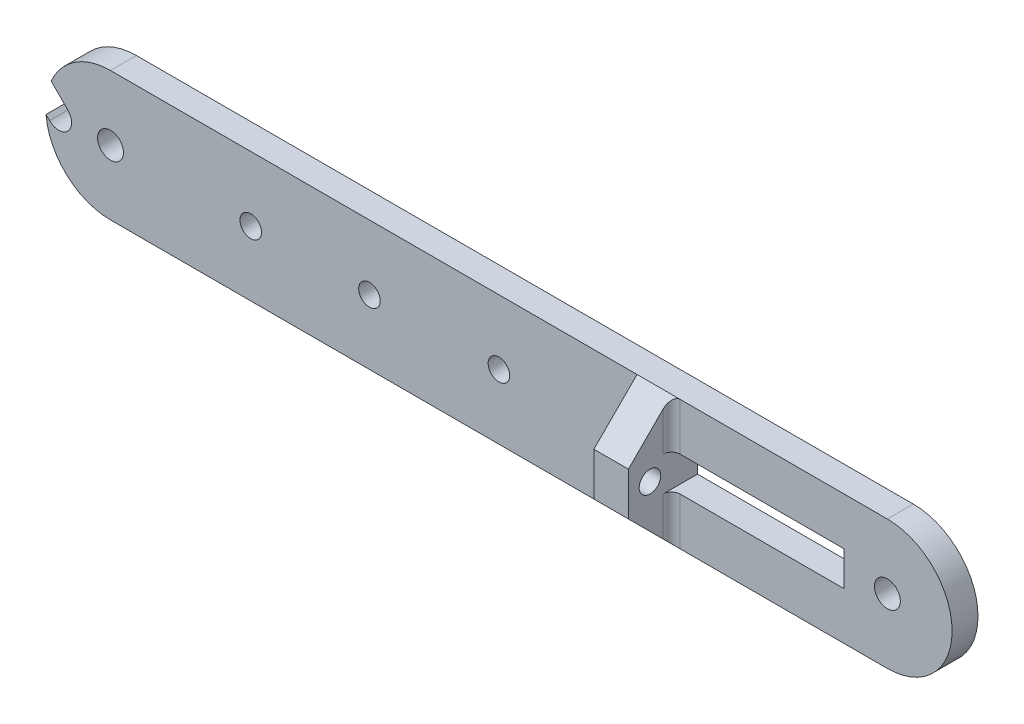
from build123d import *

# Parameters (mm, degrees)
ESQUISSE1_R             = 3
ESQUISSE1_R_2           = 2.5
ESQUISSE1_W             = 40
ESQUISSE1_H             = 8
BOSS_EXTRU_1_DEPTH      = 6
ESQUISSE2_R             = 2.5
BOSS_EXTRU_2_DEPTH      = 8
CONG_2_R                = 2
ENL_V_MAT_EXTRU_1_DEPTH = 4
ENL_V_START             = -10
ENL_V_MAT_EXTRU_4_DEPTH = 10


with BuildPart() as part:
    # Esquisse1 → Boss.-Extru.1 (new body)
    with BuildSketch(Plane.XY):
        with BuildLine():
            Line((90, -15), (-90, -15))
            ThreePointArc((-90, -15), (-105, 0), (-90, 15))
            Line((-90, 15), (90, 15))
            ThreePointArc((90, 15), (105, 0), (90, -15))
        make_face()
        with Locations((90, 0)):
            Circle(ESQUISSE1_R, mode=Mode.SUBTRACT)
        with Locations(Location((-90, 0, 0), (0, 0, 180))):
            Circle(ESQUISSE1_R, mode=Mode.SUBTRACT)
        Circle(ESQUISSE1_R_2, mode=Mode.SUBTRACT)
        with Locations((-57.5, 0)):
            Circle(ESQUISSE1_R_2, mode=Mode.SUBTRACT)
        with Locations((-30, 0)):
            Circle(ESQUISSE1_R_2, mode=Mode.SUBTRACT)
        with Locations((60, 0)):
            Rectangle(ESQUISSE1_W, ESQUISSE1_H, mode=Mode.SUBTRACT)
    extrude(amount=BOSS_EXTRU_1_DEPTH)

    # Esquisse2 → Boss.-Extru.2 (add)
    with BuildSketch(Plane(origin=(40, 0, 0), x_dir=(0, 0, -1), z_dir=(1, 0, 0))):
        Polygon((-16, 5), (-16, -5), (-6, -15), (-6, -5), (-6, 5), (-6, 15), align=None)
        with Locations((-11, 0)):
            Circle(ESQUISSE2_R, mode=Mode.SUBTRACT)
    extrude(amount=-BOSS_EXTRU_2_DEPTH)

    # Congé2
    cong_2_edges = [part.edges().sort_by_distance(p)[0] for p in [
        (40, 9.5, 6),
        (40, -9.5, 6),
    ]]
    fillet(cong_2_edges, radius=CONG_2_R)

    # Esquisse3 → Enlèv. mat.-Extru.1 (cut)
    with BuildSketch(Plane.ZY.offset(-32)):
        Polygon((11, 4), (14.464101615, 2), (14.464101615, -2), (11, -4), (7.535898385, -2), (7.535898385, 2), align=None)
    extrude(amount=-ENL_V_MAT_EXTRU_1_DEPTH, mode=Mode.SUBTRACT)

    # Esquisse4 → Enlèv. mat.-Extru.4 (cut)
    with BuildSketch(Plane.XY.offset(6).offset(ENL_V_START)):
        with BuildLine():
            ThreePointArc((-105, 0), (-104.771638598, -1.148050297), (-104.121320344, -2.121320344))
            Line((-104.121320344, -2.121320344), (-99.878679656, 2.121320344))
            ThreePointArc((-99.878679656, 2.121320344), (-103.148050297, 2.771638598), (-105, 0))
        make_face()
        with BuildLine():
            Line((-99.878679656, 2.121320344), (-104.121320344, -2.121320344))
            ThreePointArc((-104.121320344, -2.121320344), (-100.851949703, -2.771638598), (-99, 0))
            ThreePointArc((-99, 0), (-99.228361402, 1.148050297), (-99.878679656, 2.121320344))
        make_face()
        with BuildLine():
            ThreePointArc((-105, 0), (-103.148050297, 2.771638598), (-99.878679656, 2.121320344))
            Line((-99.878679656, 2.121320344), (-103.750652313, 5.993293))
            ThreePointArc((-103.750652313, 5.993293), (-104.68434174, 3.061063158), (-105, 0))
        make_face()
        with BuildLine():
            Line((-104.94364809, -1.298992597), (-104.121320344, -2.121320344))
            ThreePointArc((-104.121320344, -2.121320344), (-104.771638598, -1.148050297), (-105, 0))
            ThreePointArc((-105, 0), (-104.985905401, -0.650107165), (-104.94364809, -1.298992597))
        make_face()
        with BuildLine():
            ThreePointArc((-105, 0), (-104.771638598, -1.148050297), (-104.121320344, -2.121320344))
            Line((-104.121320344, -2.121320344), (-99.878679656, 2.121320344))
            ThreePointArc((-99.878679656, 2.121320344), (-103.148050297, 2.771638598), (-105, 0))
        make_face()
        with BuildLine():
            Line((-99.878679656, 2.121320344), (-104.121320344, -2.121320344))
            ThreePointArc((-104.121320344, -2.121320344), (-100.851949703, -2.771638598), (-99, 0))
            ThreePointArc((-99, 0), (-99.228361402, 1.148050297), (-99.878679656, 2.121320344))
        make_face()
    extrude(amount=ENL_V_MAT_EXTRU_4_DEPTH, mode=Mode.SUBTRACT)


solid = part.part
